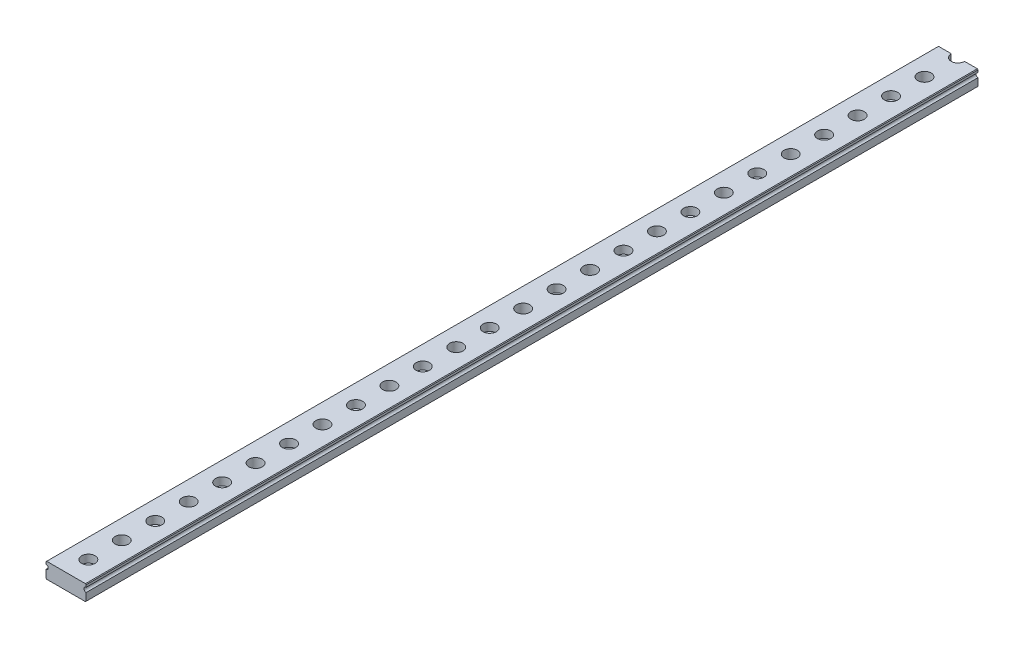
from build123d import *

# Parameters (mm, degrees)
ESBO_O1_W                                            = 18
ESBO_O1_H                                            = 400
RESSALTO_EXTRUS_O1_DEPTH                             = 3.5
FURO_DE_DI_METRO_2_0_2_1_D                           = 2
FURO_DE_DI_METRO_6_0_6_1_D                           = 6
REBAIXO_PARA_PARAFUSO_DE_M_QUINA_DE_CABE_D           = 3.5
REBAIXO_PARA_PARAFUSO_DE_M_QUINA_DE_CABE_CBORE_D     = 6
REBAIXO_PARA_PARAFUSO_DE_M_QUINA_DE_CABE_CBORE_DEPTH = 3.5
PADR_O_LINEAR1_COUNT                                 = 13
PADR_O_LINEAR1_PITCH                                 = 30
PADR_O_LINEAR2_COUNT                                 = 14
PADR_O_LINEAR2_PITCH                                 = 30
CHANFRO1_SIZE                                        = 0.3


with BuildPart() as part:
    # Esboço1 → Ressalto-extrusão1 (new, symmetric)
    with BuildSketch(Plane.XZ):
        Rectangle(ESBO_O1_W, ESBO_O1_H)
    extrude(amount=RESSALTO_EXTRUS_O1_DEPTH, both=True)

    # Furo de diâmetro Ø2.0 (2)1 (through all)
    with Locations(Plane(origin=(0, 0, -200), x_dir=(-1, 0, 0), z_dir=(0, 0, -1))):
        with Locations((-8.669077014, 4.635653864), (9, 1.2)):
            furo_de_di_metro_2_0_2_1 = Hole(FURO_DE_DI_METRO_2_0_2_1_D / 2)

    # Furo de diâmetro Ø6.0 (6)1 (through all)
    with Locations(Plane(origin=(0, 3.5, 0), x_dir=(1, 0, 0), z_dir=(0, 1, 0))):
        with Locations((0, -175)):
            furo_de_di_metro_6_0_6_1 = Hole(FURO_DE_DI_METRO_6_0_6_1_D / 2)

    # Rebaixo para parafuso de máquina de cabeça sextavada de M31 (through all)
    with Locations(Plane(origin=(0, 3.5, 0), x_dir=(1, 0, 0), z_dir=(0, 1, 0))):
        with Locations((0, -190)):
            rebaixo_para_parafuso_de_m_quina_de_cabe = CounterBoreHole(REBAIXO_PARA_PARAFUSO_DE_M_QUINA_DE_CABE_D / 2, REBAIXO_PARA_PARAFUSO_DE_M_QUINA_DE_CABE_CBORE_D / 2, REBAIXO_PARA_PARAFUSO_DE_M_QUINA_DE_CABE_CBORE_DEPTH)

    # Padrão linear1: Furo de diâmetro Ø6.0 (6)1 ×13
    with Locations(*[(0, 0, -i * PADR_O_LINEAR1_PITCH) for i in range(1, PADR_O_LINEAR1_COUNT)]):
        add(furo_de_di_metro_6_0_6_1, mode=Mode.SUBTRACT)

    # Padrão linear2: Rebaixo para parafuso de máquina de cabeça sextavada de M31 ×14
    with Locations(*[(0, 0, -i * PADR_O_LINEAR2_PITCH) for i in range(1, PADR_O_LINEAR2_COUNT)]):
        add(rebaixo_para_parafuso_de_m_quina_de_cabe, mode=Mode.SUBTRACT)

    # Chanfro1
    chanfro1_edges = [part.edges().sort_by_distance(p)[0] for p in [
        (9, 3.5, 0),
        (-9, 3.5, 0),
        (9, -3.5, 0),
        (-9, -3.5, 0),
    ]]
    chamfer(chanfro1_edges, length=CHANFRO1_SIZE)

    # Mirror1: Furo de diâmetro Ø2.0 (2)1 across plane
    add(furo_de_di_metro_2_0_2_1.mirror(Plane(origin=(0, 0, 0), x_dir=(0, 0, 1), z_dir=(1, 0, 0))), mode=Mode.SUBTRACT)


solid = part.part
